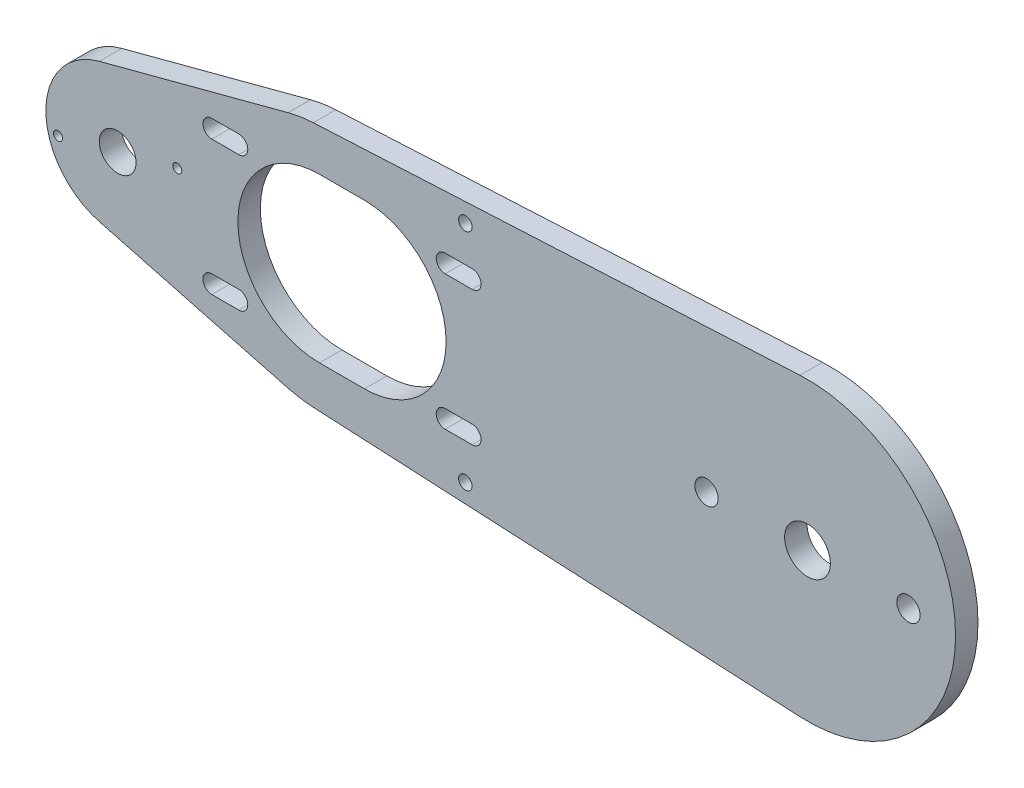
from build123d import *

# Parameters (mm, degrees)
SKETCH1_R           = 4.1
SKETCH1_R_2         = 5.1
BOSS_EXTRUDE1_DEPTH = 5
SKETCH7_R           = 2.6
CUT_EXTRUDE1_DEPTH  = 7
BOSS_EXTRUDE7_DEPTH = 8
SKETCH9_R           = 1.5
CUT_EXTRUDE2_DEPTH  = 7
CUT_EXTRUDE3_DEPTH  = 10
SKETCH11_R          = 1
CUT_EXTRUDE4_DEPTH  = 10
CUT_EXTRUDE5_START  = 5
CUT_EXTRUDE5_DEPTH  = 5


with BuildPart() as part:
    # Sketch1 → Boss-Extrude1 (new body)
    with BuildSketch(Plane.XY):
        with BuildLine():
            Line((50.206034483, 32.957769253), (-58.265804598, 27.46480771))
            ThreePointArc((-58.265804598, 27.46480771), (-61.107119662, 27.172397082), (-63.902777778, 26.586845234))
            Line((-63.902777778, 26.586845234), (-105.963888889, 15.468709954))
            ThreePointArc((-105.963888889, 15.468709954), (-117.875, 0), (-105.963888889, -15.468709954))
            Line((-105.963888889, -15.468709954), (-63.902777778, -26.586845234))
            ThreePointArc((-63.902777778, -26.586845234), (-61.107119662, -27.172397082), (-58.265804598, -27.46480771))
            Line((-58.265804598, -27.46480771), (50.206034483, -32.957769253))
            ThreePointArc((50.206034483, -32.957769253), (84.875, 0), (50.206034483, 32.957769253))
        make_face()
        with Locations((-101.875, 0)):
            Circle(SKETCH1_R, mode=Mode.SUBTRACT)
        with BuildLine():
            ThreePointArc((-46.875, 18.2), (-28.675, 0), (-46.875, -18.2))
            Line((-46.875, -18.2), (-56.875, -18.2))
            ThreePointArc((-56.875, -18.2), (-75.075, 0), (-56.875, 18.2))
            Line((-56.875, 18.2), (-46.875, 18.2))
        make_face(mode=Mode.SUBTRACT)
        with Locations((51.875, 0)):
            Circle(SKETCH1_R_2, mode=Mode.SUBTRACT)
    extrude(amount=BOSS_EXTRUDE1_DEPTH)

    # Sketch7 → Cut-Extrude1 (cut)
    with BuildSketch(Plane.XY.offset(5)):
        with Locations((29.375, 0)):
            Circle(SKETCH7_R)
        with Locations((74.375, 0)):
            Circle(SKETCH7_R)
    extrude(amount=-CUT_EXTRUDE1_DEPTH, mode=Mode.SUBTRACT)

    # Sketch8 → Boss-Extrude7 (add)
    with BuildSketch(Plane.XY.offset(5)):
        Polygon((-28.993802154, 25), (-26.684401077, 21), (-22.065598923, 21), (-19.756197846, 25), (-22.065598923, 29), (-26.684401077, 29), align=None)
        Polygon((-25.775, 27.424871131), (-27.175, 25), (-25.775, 22.575128869), (-22.975, 22.575128869), (-21.575, 25), (-22.975, 27.424871131), align=None, mode=Mode.SUBTRACT)
    extrude(amount=-BOSS_EXTRUDE7_DEPTH)

    # Sketch9 → Cut-Extrude2 (cut)
    with BuildSketch(Plane.XY.offset(5)):
        with Locations((-24.375, 25)):
            Circle(SKETCH9_R)
    cut_extrude2 = extrude(amount=-CUT_EXTRUDE2_DEPTH, mode=Mode.SUBTRACT)

    # Mirror2: Cut-Extrude2 across plane
    add(cut_extrude2.mirror(Plane.ZX), mode=Mode.SUBTRACT)

    # Sketch10 → Cut-Extrude3 (cut)
    with BuildSketch(Plane.XY.offset(5)):
        with BuildLine():
            Line((-80.875, 13), (-74.875, 13))
            ThreePointArc((-74.875, 13), (-72.875, 15), (-74.875, 17))
            Line((-74.875, 17), (-80.875, 17))
            ThreePointArc((-80.875, 17), (-82.875, 15), (-80.875, 13))
        make_face()
        with BuildLine():
            ThreePointArc((-74.875, -13), (-72.875, -15), (-74.875, -17))
            Line((-74.875, -17), (-80.875, -17))
            ThreePointArc((-80.875, -17), (-82.875, -15), (-80.875, -13))
            Line((-80.875, -13), (-74.875, -13))
        make_face()
        with BuildLine():
            Line((-22.875, -13), (-28.875, -13))
            ThreePointArc((-28.875, -13), (-30.875, -15), (-28.875, -17))
            Line((-28.875, -17), (-22.875, -17))
            ThreePointArc((-22.875, -17), (-20.875, -15), (-22.875, -13))
        make_face()
        with BuildLine():
            ThreePointArc((-28.875, 13), (-30.875, 15), (-28.875, 17))
            Line((-28.875, 17), (-22.875, 17))
            ThreePointArc((-22.875, 17), (-20.875, 15), (-22.875, 13))
            Line((-22.875, 13), (-28.875, 13))
        make_face()
    extrude(amount=-CUT_EXTRUDE3_DEPTH, mode=Mode.SUBTRACT)

    # Sketch11 → Cut-Extrude4 (cut)
    with BuildSketch(Plane.XY.offset(5)):
        with Locations((-115.168208365, -3.514699328)):
            Circle(SKETCH11_R)
        with Locations((-88.581791635, 3.514699328)):
            Circle(SKETCH11_R)
    extrude(amount=-CUT_EXTRUDE4_DEPTH, mode=Mode.SUBTRACT)

    # Sketch12 → Cut-Extrude5 (cut)
    with BuildSketch(Plane(origin=(0, 0, 0), x_dir=(-1, 0, 0), z_dir=(0, 0, -1)).offset(CUT_EXTRUDE5_START)):
        with BuildLine():
            Line((105.963888889, 15.468709954), (63.902777778, 26.586845234))
            ThreePointArc((63.902777778, 26.586845234), (61.107119662, 27.172397082), (58.265804598, 27.46480771))
            Line((58.265804598, 27.46480771), (-50.206034483, 32.957769253))
            ThreePointArc((-50.206034483, 32.957769253), (-84.875, 0), (-50.206034483, -32.957769253))
            Line((-50.206034483, -32.957769253), (58.265804598, -27.46480771))
            ThreePointArc((58.265804598, -27.46480771), (61.107119662, -27.172397082), (63.902777778, -26.586845234))
            Line((63.902777778, -26.586845234), (105.963888889, -15.468709954))
            ThreePointArc((105.963888889, -15.468709954), (117.875, 0), (105.963888889, 15.468709954))
        make_face()
    extrude(amount=-CUT_EXTRUDE5_DEPTH, mode=Mode.SUBTRACT)


solid = part.part
